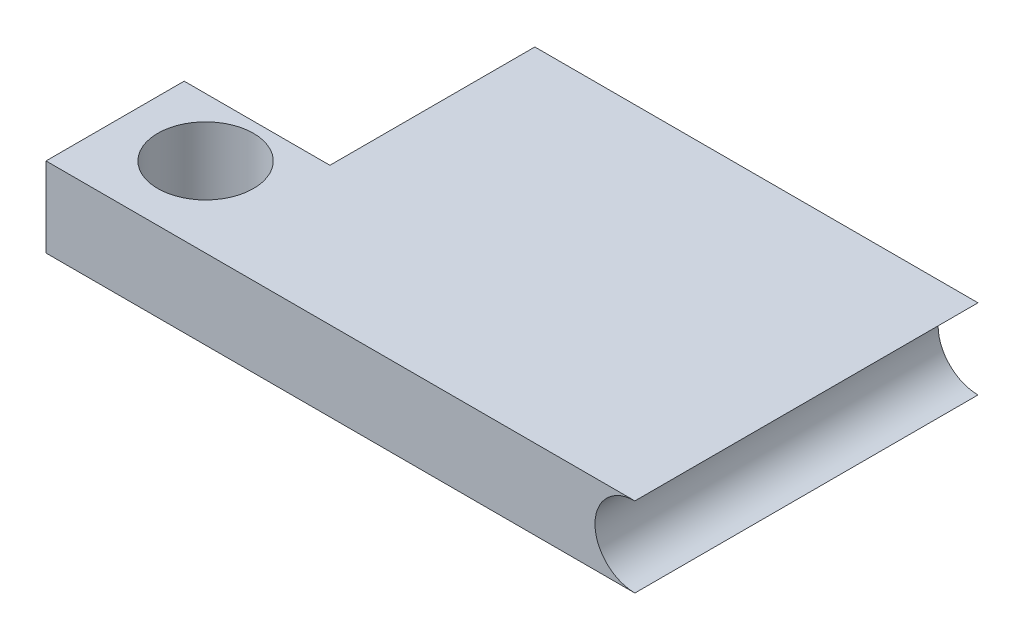
from build123d import *

# Parameters (mm, degrees)
SKETCH1_W           = 1106.97250468
SKETCH1_H           = 150
BOSS_EXTRUDE1_DEPTH = 645
SKETCH2_R           = 90
CUT_EXTRUDE1_DEPTH  = 1290.927566229
SKETCH3_W           = 273.936328983
SKETCH3_H           = 385.258703225
CUT_EXTRUDE2_DEPTH  = 1290.927566229
CUT_EXTRUDE3_DEPTH  = 1290.927566229


with BuildPart() as part:
    # Sketch1 → Boss-Extrude1 (new body)
    with BuildSketch(Plane.XY):
        with Locations((553.48625234, 75)):
            Rectangle(SKETCH1_W, SKETCH1_H)
    extrude(amount=BOSS_EXTRUDE1_DEPTH)

    # Sketch2 → Cut-Extrude1 (cut, through all)
    with BuildSketch(Plane.XZ):
        with Locations(Location((150, 495, 0), (0, 0, 270))):
            Circle(SKETCH2_R)
    extrude(amount=-CUT_EXTRUDE1_DEPTH, mode=Mode.SUBTRACT)

    # Sketch3 → Cut-Extrude2 (cut, through all)
    with BuildSketch(Plane.XZ):
        with Locations((136.968164492, 192.629351613)):
            Rectangle(SKETCH3_W, SKETCH3_H)
    extrude(amount=-CUT_EXTRUDE2_DEPTH, mode=Mode.SUBTRACT)

    # Sketch5 → Cut-Extrude3 (cut, through all)
    with BuildSketch(Plane.XY.offset(645)):
        with BuildLine():
            Line((1106.97250468, 150), (1106.97250468, 0))
            ThreePointArc((1106.97250468, 0), (1031.97250468, 75), (1106.97250468, 150))
        make_face()
    extrude(amount=-CUT_EXTRUDE3_DEPTH, mode=Mode.SUBTRACT)


solid = part.part
